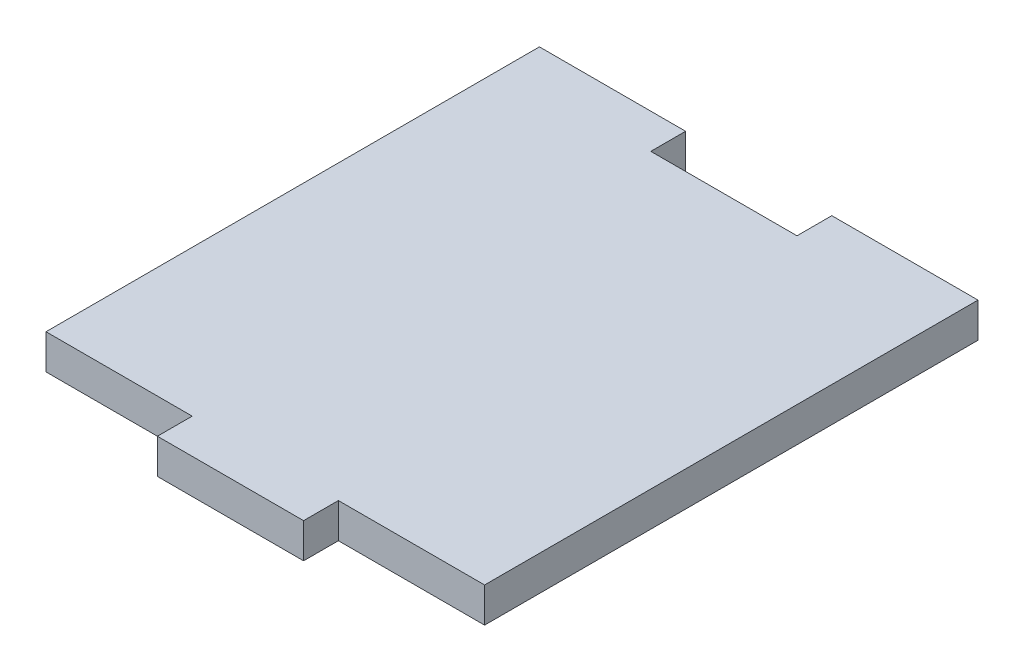
from build123d import *

# Parameters (mm, degrees)
BOSS_EXTRUDE1_DEPTH = 3.175


with BuildPart() as part:
    # Sketch1 → Boss-Extrude1 (new body)
    with BuildSketch(Plane(origin=(0, 0, 0), x_dir=(1, 0, 0), z_dir=(0, 1, 0))):
        Polygon((13.333333333, 0), (13.333333333, -3.175), (26.666666667, -3.175), (26.666666667, 0), (40, 0), (40, 45), (26.666666667, 45), (26.666666667, 41.825), (13.333333333, 41.825), (13.333333333, 45), (0, 45), (0, 0), align=None)
    extrude(amount=BOSS_EXTRUDE1_DEPTH)


solid = part.part
